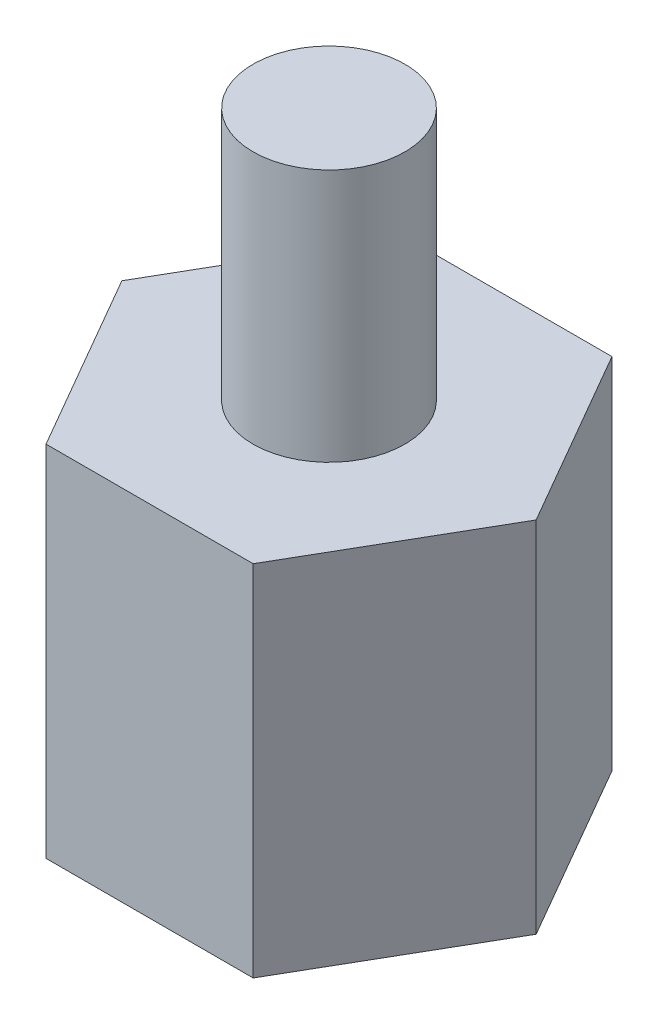
from build123d import *

# Parameters (mm, degrees)
BOSS_EXTRUDE1_DEPTH = 6.2992
SKETCH2_R           = 1.3335
BOSS_EXTRUDE2_DEPTH = 4.445
SKETCH3_R           = 1.27
CUT_EXTRUDE1_DEPTH  = 3.81


with BuildPart() as part:
    # Sketch1 → Boss-Extrude1 (new body)
    with BuildSketch(Plane(origin=(0, 0, 0), x_dir=(1, 0, 0), z_dir=(0, 1, 0))):
        Polygon((3.636844816, 0), (1.818422408, 3.1496), (-1.818422408, 3.1496), (-3.636844816, 0), (-1.818422408, -3.1496), (1.818422408, -3.1496), align=None)
    extrude(amount=BOSS_EXTRUDE1_DEPTH)

    # Sketch2 → Boss-Extrude2 (add)
    with BuildSketch(Plane(origin=(0, 6.2992, 0), x_dir=(-1, 0, 0), z_dir=(0, 1, 0))):
        with Locations(Location((0, 0, 0), (0, 0, 90))):
            Circle(SKETCH2_R)
    extrude(amount=BOSS_EXTRUDE2_DEPTH)

    # Sketch3 → Cut-Extrude1 (cut)
    with BuildSketch(Plane.XZ):
        with Locations(Location((0, 0, 0), (0, 0, 270))):
            Circle(SKETCH3_R)
    extrude(amount=-CUT_EXTRUDE1_DEPTH, mode=Mode.SUBTRACT)


solid = part.part
